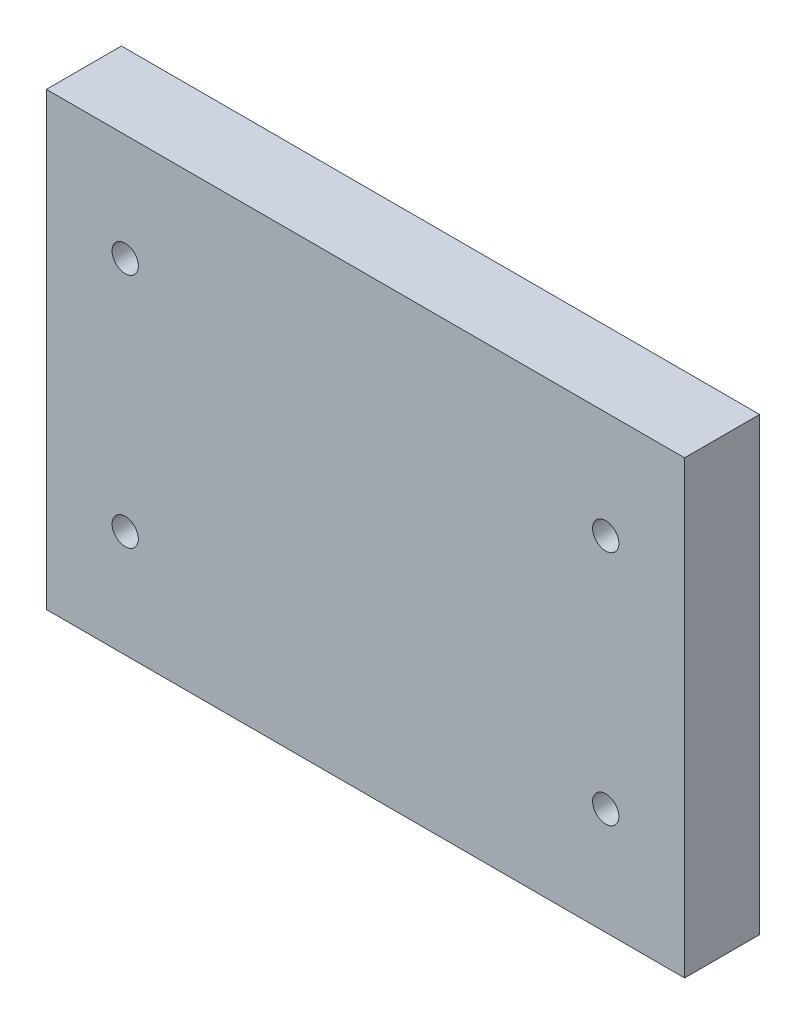
from build123d import *

# Parameters (mm, degrees)
SKETCH_1_W          = 85
SKETCH_1_H          = 60
EXTRUDE_1_DEPTH     = 10
SKETCH_2_R          = 1.75
CUT_EXTRUDE_1_DEPTH = 10


with BuildPart() as part:
    # 草图1 → 凸台-拉伸1 (new body)
    with BuildSketch(Plane.XY):
        Rectangle(SKETCH_1_W, SKETCH_1_H)
    extrude(amount=EXTRUDE_1_DEPTH)

    # 草图2 → 切除-拉伸1 (cut)
    with BuildSketch(Plane.XY.offset(10)):
        with Locations((-32, 15.75)):
            Circle(SKETCH_2_R)
        with Locations((-32, -15.75)):
            Circle(SKETCH_2_R)
        with Locations((32, 15.75)):
            Circle(SKETCH_2_R)
        with Locations((32, -15.75)):
            Circle(SKETCH_2_R)
    extrude(amount=-CUT_EXTRUDE_1_DEPTH, mode=Mode.SUBTRACT)


solid = part.part
